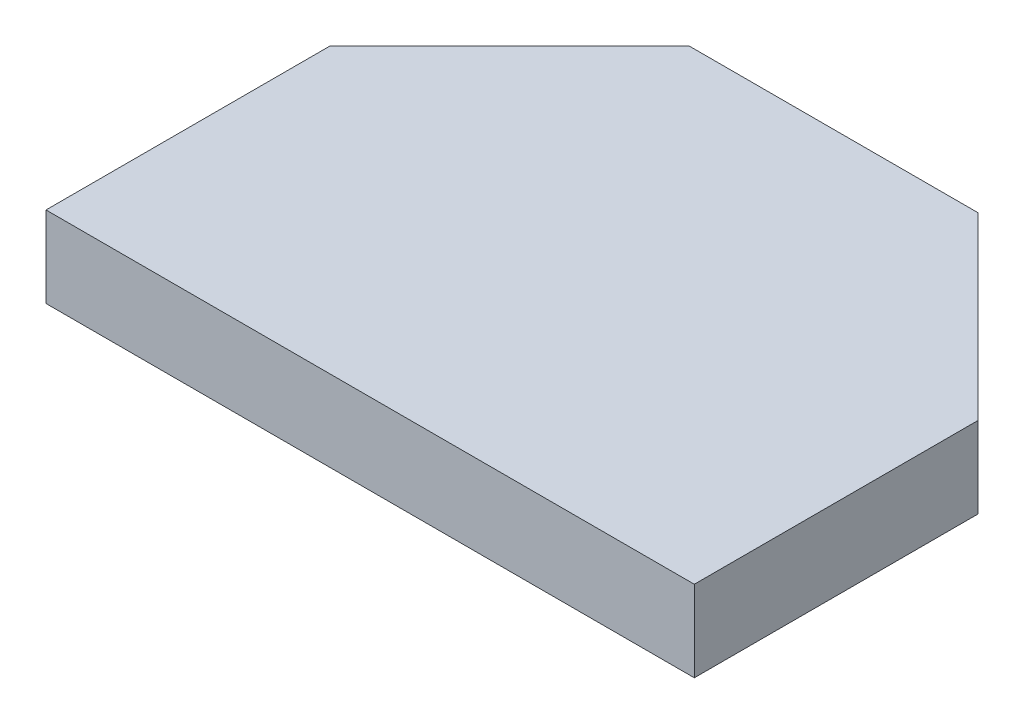
from build123d import *

# Parameters (mm, degrees)
BOSS_EXTRUDE1_DEPTH = 12.7


with BuildPart() as part:
    # Sketch1 → Boss-Extrude1 (new body)
    with BuildSketch(Plane(origin=(0, 0, 0), x_dir=(1, 0, 0), z_dir=(0, 1, 0))):
        Polygon((0, 0), (101.6, 0), (101.6, 44.45), (73.406, 72.652007872), (28.19800422, 72.64800422), (0, 44.45), align=None)
    extrude(amount=BOSS_EXTRUDE1_DEPTH)


solid = part.part
